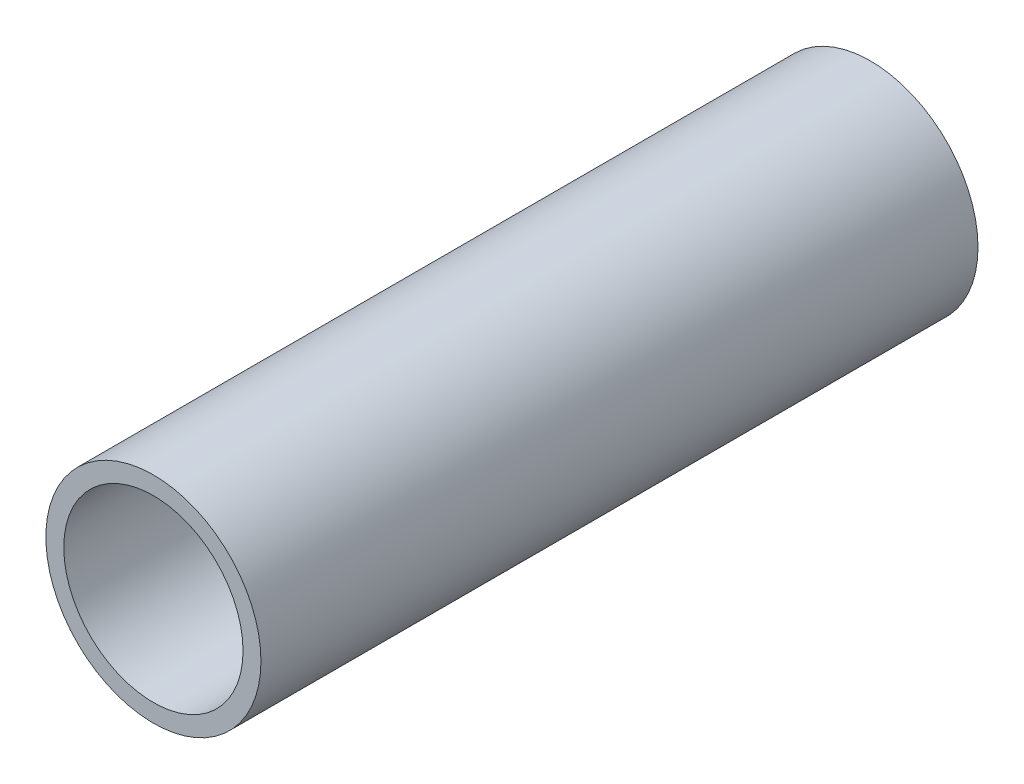
from build123d import *

# Parameters (mm, degrees)
SKETCH1_R           = 30
SKETCH1_R_2         = 25
BOSS_EXTRUDE1_DEPTH = 200


with BuildPart() as part:
    # Sketch1 → Boss-Extrude1 (new body)
    with BuildSketch(Plane.XY):
        Circle(SKETCH1_R)
        Circle(SKETCH1_R_2, mode=Mode.SUBTRACT)
    extrude(amount=BOSS_EXTRUDE1_DEPTH)


solid = part.part
